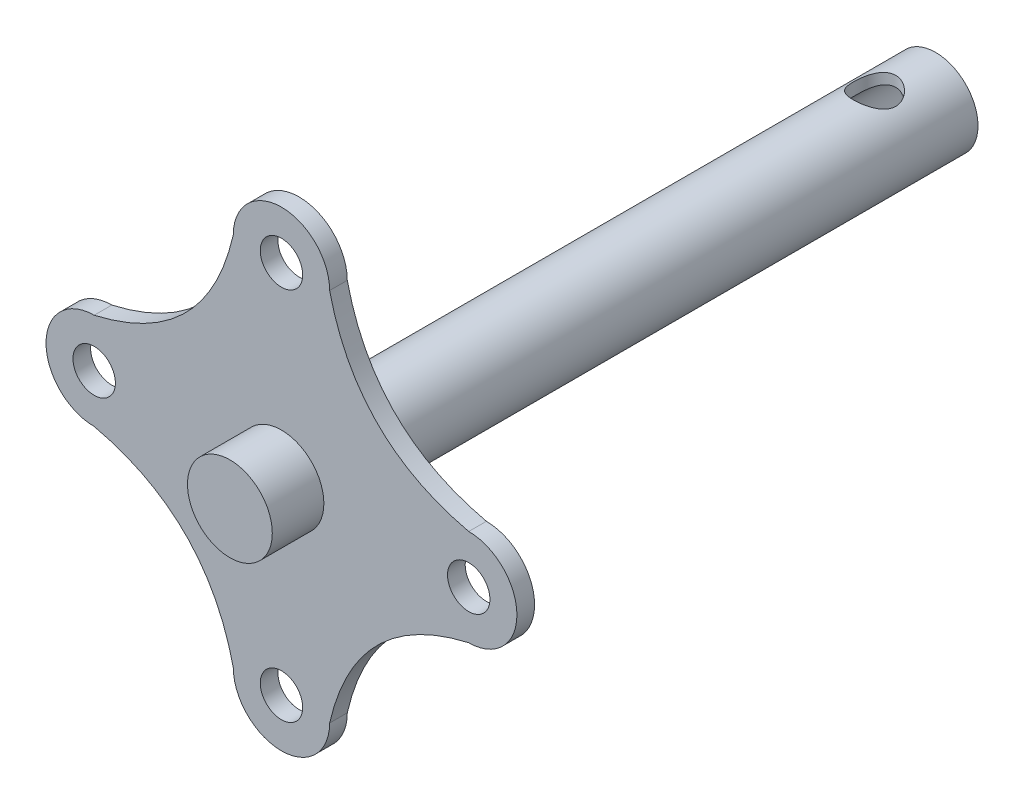
from build123d import *

# Parameters (mm, degrees)
SKETCH1_R               = 3.96875
BOSS_EXTRUDE1_DEPTH     = 3.302
SKETCH2_R               = 7.9375
BOSS_EXTRUDE2_DEPTH     = 9.652
BOSS_EXTRUDE3_START     = 119.126
SKETCH3_R               = 7.9375
BOSS_EXTRUDE3_DEPTH     = 119.126
SKETCH4_R               = 6
CUT_EXTRUDE1_DEPTH      = 25.4
CUT_EXTRUDE2_REACH      = 140.108
CUT_EXTRUDE2_END_RADIUS = 6
SKETCH5_R               = 3.96875


with BuildPart() as part:
    # Sketch1 → Boss-Extrude1 (new body)
    with BuildSketch(Plane.XY):
        with BuildLine():
            ThreePointArc((9.017, 35.052), (0, 44.069), (-9.017, 35.052))
            add(Edge.make_bspline(
                [(-9.017, 35.052), (-13.886524484, 13.886524484), (-35.052, 9.017)],
                knots=[0, 0, 0, 1, 1, 1], degree=2))
            ThreePointArc((-35.052, 9.017), (-44.069, 0), (-35.052, -9.017))
            add(Edge.make_bspline(
                [(-35.052, -9.017), (-13.886524484, -13.886524484), (-9.017, -35.052)],
                knots=[0, 0, 0, 1, 1, 1], degree=2))
            ThreePointArc((-9.017, -35.052), (0, -44.069), (9.017, -35.052))
            add(Edge.make_bspline(
                [(35.052, -9.017), (13.886524484, -13.886524484), (9.017, -35.052)],
                knots=[0, 0, 0, 1, 1, 1], degree=2))
            ThreePointArc((35.052, -9.017), (44.069, 0), (35.052, 9.017))
            add(Edge.make_bspline(
                [(9.017, 35.052), (13.886524484, 13.886524484), (35.052, 9.017)],
                knots=[0, 0, 0, 1, 1, 1], degree=2))
        make_face()
        with Locations(Location((0, 35.052, 0), (0, 0, 180))):
            Circle(SKETCH1_R, mode=Mode.SUBTRACT)
        with Locations(Location((35.052, 0, 0), (0, 0, 180))):
            Circle(SKETCH1_R, mode=Mode.SUBTRACT)
        with Locations(Location((0, -35.052, 0), (0, 0, 180))):
            Circle(SKETCH1_R, mode=Mode.SUBTRACT)
        with Locations(Location((-35.052, 0, 0), (0, 0, 180))):
            Circle(SKETCH1_R, mode=Mode.SUBTRACT)
    extrude(amount=BOSS_EXTRUDE1_DEPTH)

    # Sketch2 → Boss-Extrude2 (add)
    with BuildSketch(Plane.XY.offset(3.302)):
        Circle(SKETCH2_R)
    extrude(amount=BOSS_EXTRUDE2_DEPTH)

    # Sketch3 → Boss-Extrude3 (add)
    with BuildSketch(Plane(origin=(0, 0, 0), x_dir=(-1, 0, 0), z_dir=(0, 0, -1)).offset(BOSS_EXTRUDE3_START)):
        with Locations(Location((0, 0, 0), (0, 0, 180))):
            Circle(SKETCH3_R)
    extrude(amount=-BOSS_EXTRUDE3_DEPTH)

    # Sketch4 → Cut-Extrude1 (cut)
    with BuildSketch(Plane(origin=(0, 0, -119.126), x_dir=(-1, 0, 0), z_dir=(0, 0, -1))):
        Circle(SKETCH4_R)
    extrude(amount=-CUT_EXTRUDE1_DEPTH, mode=Mode.SUBTRACT)

    # Cut-Extrude2: up to this cylinder (the profile starts outside it)
    cut_extrude2_end = Plane(origin=(0, 0, -107.696), z_dir=(0, 0, -1)) * Cylinder(CUT_EXTRUDE2_END_RADIUS, 293.216, mode=Mode.PRIVATE)
    # Sketch5 → Cut-Extrude2 (cut, up to the surface)
    with BuildSketch(Plane(origin=(0, 10.16, 0), x_dir=(1, 0, 0), z_dir=(0, 1, 0)), mode=Mode.PRIVATE) as cut_extrude2_sk1:
        with Locations(Location((0, 107.696, 0), (0, 0, 270))):
            Circle(SKETCH5_R)
    cut_extrude2_tool1 = extrude(cut_extrude2_sk1.sketch, amount=-CUT_EXTRUDE2_REACH, mode=Mode.PRIVATE) - cut_extrude2_end
    add(cut_extrude2_tool1.solids().sort_by_distance((0, 10.16, -107.696))[0], mode=Mode.SUBTRACT)


solid = part.part
